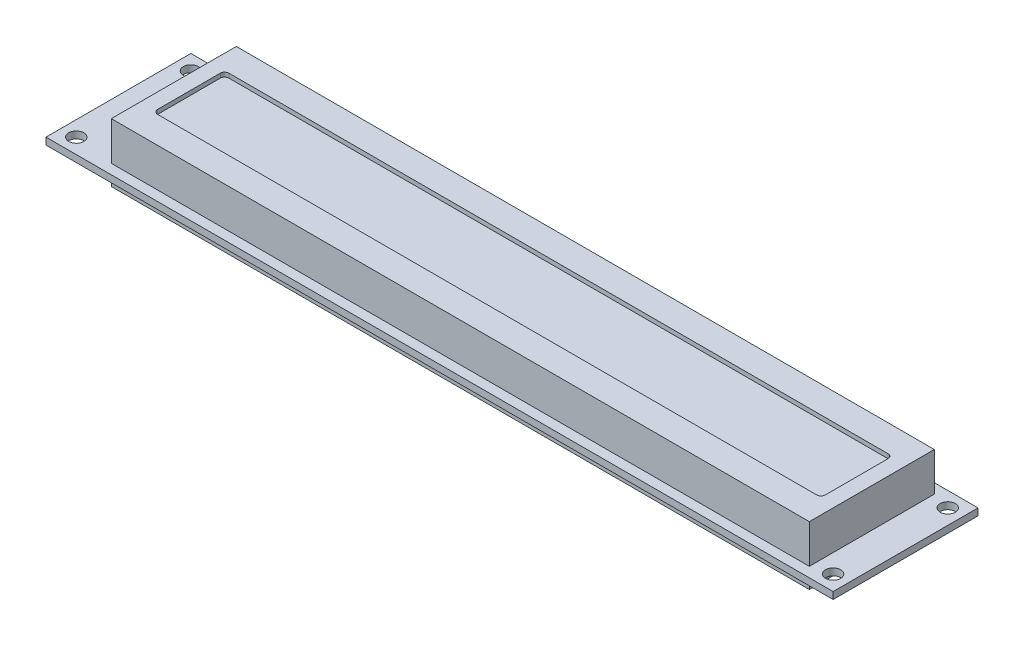
from build123d import *

# Parameters (mm, degrees)
SKETCH1_W            = 182
SKETCH1_H            = 33.5
BOSS_EXTRUDE1_DEPTH  = 1.6
SKETCH2_R            = 1.75
CUT_EXTRUDE1_DEPTH   = 1.6
LPATTERN1_COUNT      = 2
LPATTERN1_PITCH      = 175
LPATTERN1_COUNT_DIR2 = 2
LPATTERN1_PITCH_DIR2 = 26.5
SKETCH3_W            = 161.4
SKETCH3_H            = 28.9
BOSS_EXTRUDE2_DEPTH  = 8.95
SKETCH3_2_W          = 161.4
SKETCH3_2_H          = 28.9
BOSS_EXTRUDE3_DEPTH  = 4.65
SKETCH4_W            = 154.4
SKETCH4_H            = 16.5
CUT_EXTRUDE2_DEPTH   = 1
FILLET1_R            = 1
FILLET2_R            = 1
FILLET3_R            = 1
FILLET4_R            = 1


with BuildPart() as part:
    # Sketch1 → Boss-Extrude1 (new body)
    with BuildSketch(Plane(origin=(0, 0, 0), x_dir=(1, 0, 0), z_dir=(0, 1, 0))):
        with Locations((10.727604206, -13.815258398)):
            Rectangle(SKETCH1_W, SKETCH1_H)
    extrude(amount=BOSS_EXTRUDE1_DEPTH)

    # Sketch2 → Cut-Extrude1 (cut)
    with BuildSketch(Plane(origin=(0, 1.6, 0), x_dir=(1, 0, 0), z_dir=(0, 1, 0))):
        with Locations((-76.772395794, -0.565258398)):
            Circle(SKETCH2_R)
    cut_extrude1 = extrude(amount=-CUT_EXTRUDE1_DEPTH, mode=Mode.SUBTRACT)

    # LPattern1: Cut-Extrude1 2 × 2
    with Locations(*[(i * LPATTERN1_PITCH, 0, j * LPATTERN1_PITCH_DIR2) for i in range(LPATTERN1_COUNT) for j in range(LPATTERN1_COUNT_DIR2) if (i, j) != (0, 0)]):
        add(cut_extrude1, mode=Mode.SUBTRACT)

    # Sketch3 → Boss-Extrude2 (add)
    with BuildSketch(Plane(origin=(0, 1.6, 0), x_dir=(1, 0, 0), z_dir=(0, 1, 0))):
        with Locations((13.227604206, -13.815258398)):
            Rectangle(SKETCH3_W, SKETCH3_H)
    extrude(amount=BOSS_EXTRUDE2_DEPTH)

    # Sketch3<2> → Boss-Extrude3 (add)
    with BuildSketch(Plane(origin=(0, 1.6, 0), x_dir=(1, 0, 0), z_dir=(0, 1, 0))):
        with Locations((13.227604206, -13.815258398)):
            Rectangle(SKETCH3_2_W, SKETCH3_2_H)
    extrude(amount=-BOSS_EXTRUDE3_DEPTH)

    # Sketch4 → Cut-Extrude2 (cut)
    with BuildSketch(Plane(origin=(0, 10.55, 0), x_dir=(1, 0, 0), z_dir=(0, 1, 0))):
        with Locations((13.227604206, -13.815258398)):
            Rectangle(SKETCH4_W, SKETCH4_H)
    extrude(amount=-CUT_EXTRUDE2_DEPTH, mode=Mode.SUBTRACT)

    # Fillet1
    fillet1_edges = [part.edges().sort_by_distance(p)[0] for p in [
        (-63.972395794, 10.05, 5.565258398),
    ]]
    fillet(fillet1_edges, radius=FILLET1_R)

    # Fillet2
    fillet2_edges = [part.edges().sort_by_distance(p)[0] for p in [
        (-63.972395794, 10.05, 22.065258398),
    ]]
    fillet(fillet2_edges, radius=FILLET2_R)

    # Fillet3
    fillet3_edges = [part.edges().sort_by_distance(p)[0] for p in [
        (90.427604206, 10.05, 5.565258398),
    ]]
    fillet(fillet3_edges, radius=FILLET3_R)

    # Fillet4
    fillet4_edges = [part.edges().sort_by_distance(p)[0] for p in [
        (90.427604206, 10.05, 22.065258398),
    ]]
    fillet(fillet4_edges, radius=FILLET4_R)


solid = part.part
